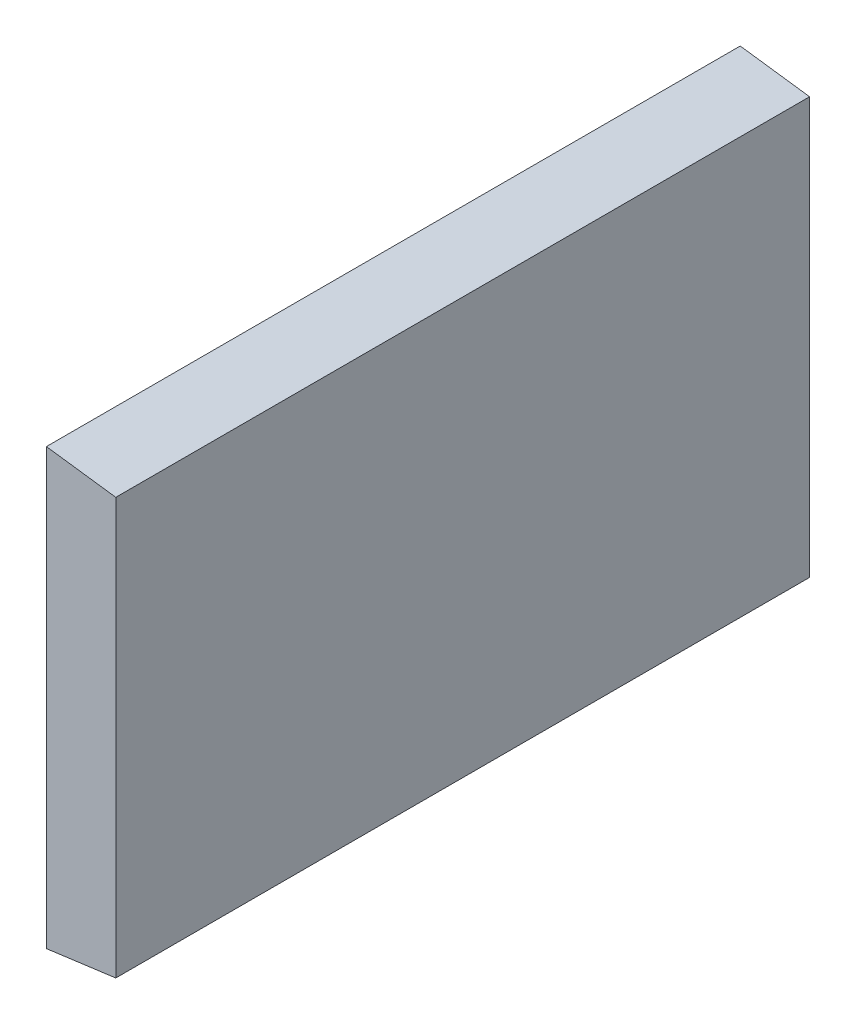
from build123d import *

# Parameters (mm, degrees)
BOSS_EXTRUDE1_DEPTH = 100


with BuildPart() as part:
    # Sketch1 → Boss-Extrude1 (new body)
    with BuildSketch(Plane.XY):
        Polygon((10, -1.333333333), (0, 0), (0, -62.666666667), (10, -61.333333333), align=None)
    extrude(amount=BOSS_EXTRUDE1_DEPTH)


solid = part.part
